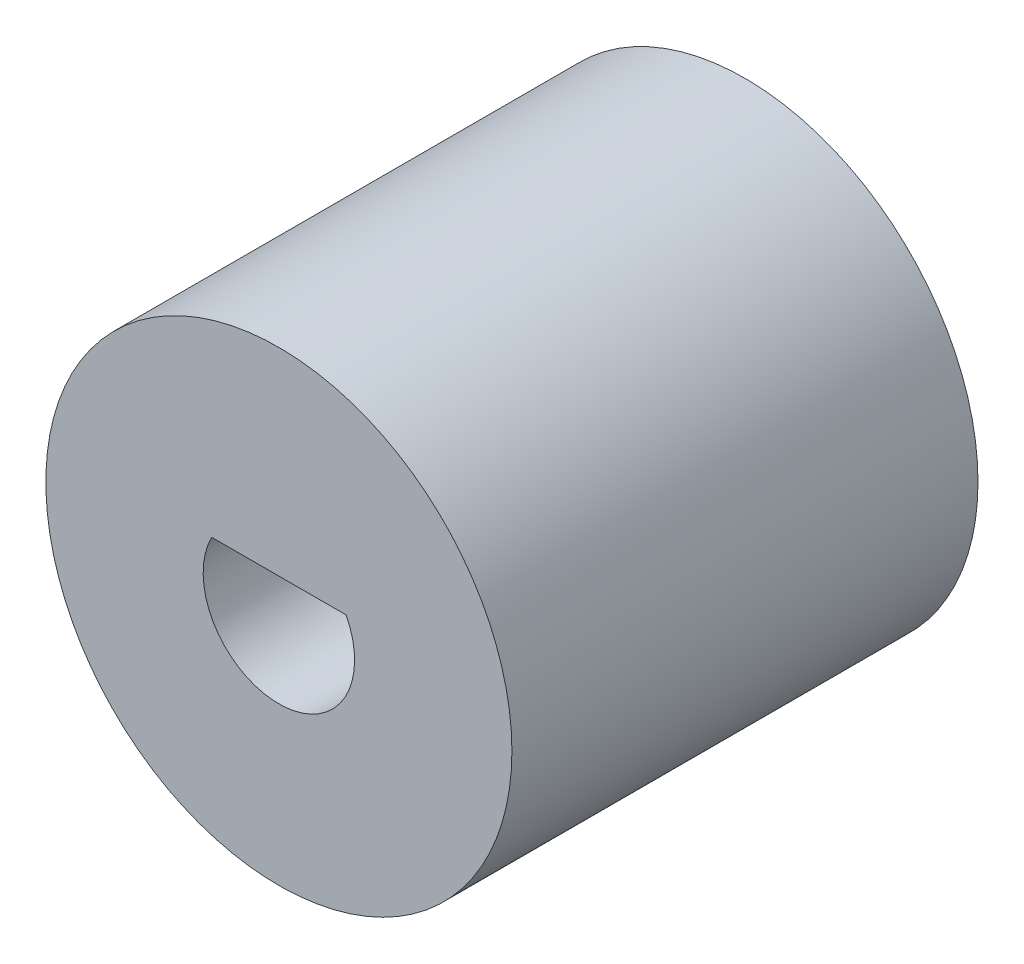
from build123d import *

# Parameters (mm, degrees)
SKETCH1_R           = 5
BOSS_EXTRUDE1_DEPTH = 10
CUT_EXTRUDE1_DEPTH  = 5
SKETCH3_R           = 2.9
CUT_EXTRUDE2_DEPTH  = 5


with BuildPart() as part:
    # Sketch1 → Boss-Extrude1 (new body)
    with BuildSketch(Plane.XY):
        Circle(SKETCH1_R)
    extrude(amount=BOSS_EXTRUDE1_DEPTH)

    # Sketch2 → Cut-Extrude1 (cut)
    with BuildSketch(Plane.XY.offset(10)):
        with BuildLine():
            Line((-1.441570324, 0.75), (1.441570324, 0.75))
            ThreePointArc((1.441570324, 0.75), (0, -1.625), (-1.441570324, 0.75))
        make_face()
    extrude(amount=-CUT_EXTRUDE1_DEPTH, mode=Mode.SUBTRACT)

    # Sketch3 → Cut-Extrude2 (cut)
    with BuildSketch(Plane(origin=(0, 0, 0), x_dir=(-1, 0, 0), z_dir=(0, 0, -1))):
        Circle(SKETCH3_R)
    extrude(amount=-CUT_EXTRUDE2_DEPTH, mode=Mode.SUBTRACT)


solid = part.part
